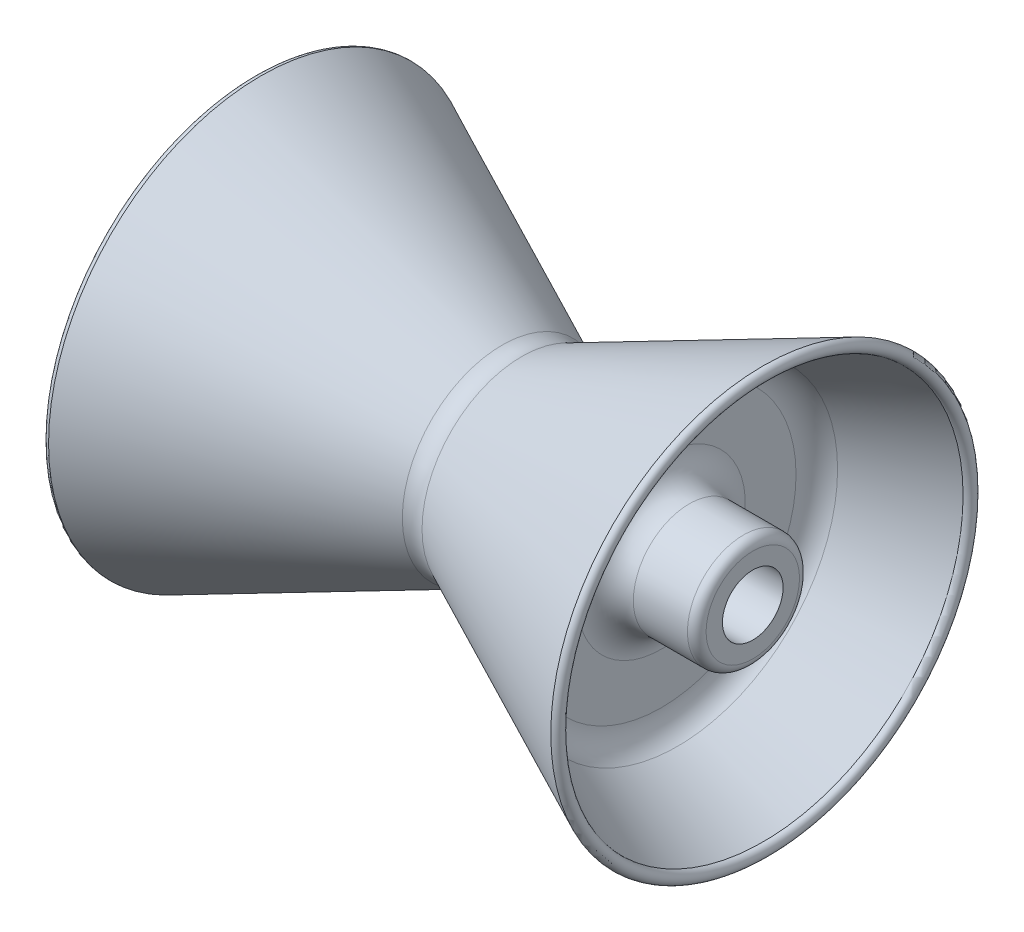
from build123d import *


with BuildPart() as part:
    # Sketch1 → Revolve1 (revolve)
    with BuildSketch(Plane.XY, mode=Mode.PRIVATE) as revolve1_sk:
        with BuildLine():
            Line((-2.886908691, 90.121897945), (-87.321452148, 129.494372172))
            ThreePointArc((-87.321452148, 129.494372172), (-116.11898825, 127.606881935), (-130, 102.305138561))
            Line((-130, 102.305138561), (-130, 32.5))
            Line((-130, 32.5), (-257.940415619, 32.5))
            Line((-257.940415619, 32.5), (-257.940415619, 50))
            ThreePointArc((-257.940415619, 50), (-255.011483431, 57.071067812), (-247.940415619, 60))
            Line((-247.940415619, 60), (-190, 60))
            ThreePointArc((-190, 60), (-168.786796564, 68.786796564), (-160, 90))
            Line((-160, 90), (-160, 144.272827794))
            ThreePointArc((-160, 144.272827794), (-164.698256626, 160.391816045), (-177.321452148, 171.462061406))
            Line((-177.321452148, 171.462061406), (-269.015, 214.219464972))
            ThreePointArc((-269.015, 214.219464972), (-275.635267514, 220.839732486), (-269.015, 227.46))
            Line((-269.015, 227.46), (-10.565456544, 106.94299864))
            ThreePointArc((-10.565456544, 106.94299864), (0, 104.600693315), (10.565456544, 106.94299864))
            Line((10.565456544, 106.94299864), (269.015, 227.46))
            ThreePointArc((269.015, 227.46), (275.635267514, 220.839732486), (269.015, 214.219464972))
            Line((269.015, 214.219464972), (177.321452148, 171.462061406))
            ThreePointArc((177.321452148, 171.462061406), (164.698256626, 160.391816045), (160, 144.272827794))
            Line((160, 144.272827794), (160, 90))
            ThreePointArc((160, 90), (168.786796564, 68.786796564), (190, 60))
            Line((190, 60), (247.940415619, 60))
            ThreePointArc((247.940415619, 60), (255.011483431, 57.071067812), (257.940415619, 50))
            Line((257.940415619, 50), (257.940415619, 32.5))
            Line((257.940415619, 32.5), (130, 32.5))
            Line((130, 32.5), (130, 102.305138561))
            ThreePointArc((130, 102.305138561), (116.11898825, 127.606881935), (87.321452148, 129.494372172))
            Line((87.321452148, 129.494372172), (2.886908691, 90.121897945))
            ThreePointArc((2.886908691, 90.121897945), (0.783042771, 88.276857052), (0, 85.59035901))
            ThreePointArc((0, 85.59035901), (-0.783042771, 88.276857052), (-2.886908691, 90.121897945))
        make_face()
    revolve(revolve1_sk.sketch.rotate(Axis((-289.838709677, 0, 0), (1, 0, 0)), 90), axis=Axis((-289.838709677, 0, 0), (1, 0, 0)))


solid = part.part
